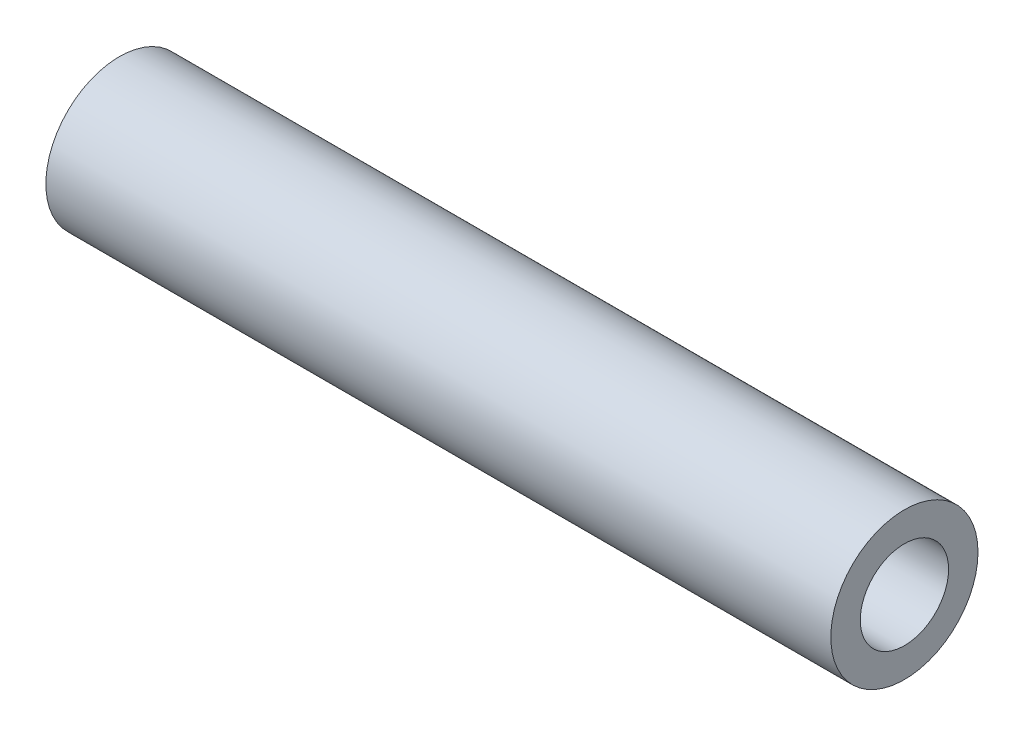
from build123d import *

# Parameters (mm, degrees)
SKETCH1_R           = 3.81
SKETCH1_R_2         = 2.286
BOSS_EXTRUDE1_DEPTH = 40.64


with BuildPart() as part:
    # Sketch1 → Boss-Extrude1 (new body)
    with BuildSketch(Plane(origin=(0, 0, 0), x_dir=(0, 0, -1), z_dir=(1, 0, 0))):
        Circle(SKETCH1_R)
        Circle(SKETCH1_R_2, mode=Mode.SUBTRACT)
    extrude(amount=BOSS_EXTRUDE1_DEPTH)


solid = part.part
